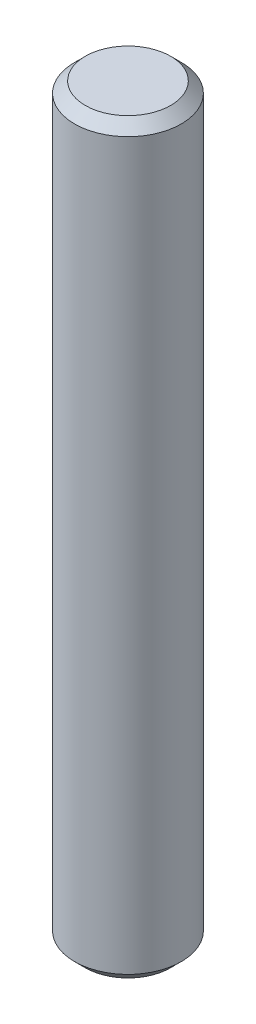
from build123d import *

# Parameters (mm, degrees)
SKETCH1_R           = 3.175
BOSS_EXTRUDE1_DEPTH = 44.45
CHAMFER1_SIZE       = 0.635


with BuildPart() as part:
    # Sketch1 → Boss-Extrude1 (new body)
    with BuildSketch(Plane(origin=(0, 0, 0), x_dir=(1, 0, 0), z_dir=(0, 1, 0))):
        with Locations(Location((0, 0, 0), (0, 0, 270))):
            Circle(SKETCH1_R)
    extrude(amount=BOSS_EXTRUDE1_DEPTH)

    # Chamfer1
    chamfer1_edges = [part.edges().sort_by_distance(p)[0] for p in [
        (0, 0, -3.175),
        (0, 44.45, -3.175),
    ]]
    chamfer(chamfer1_edges, length=CHAMFER1_SIZE)


solid = part.part
